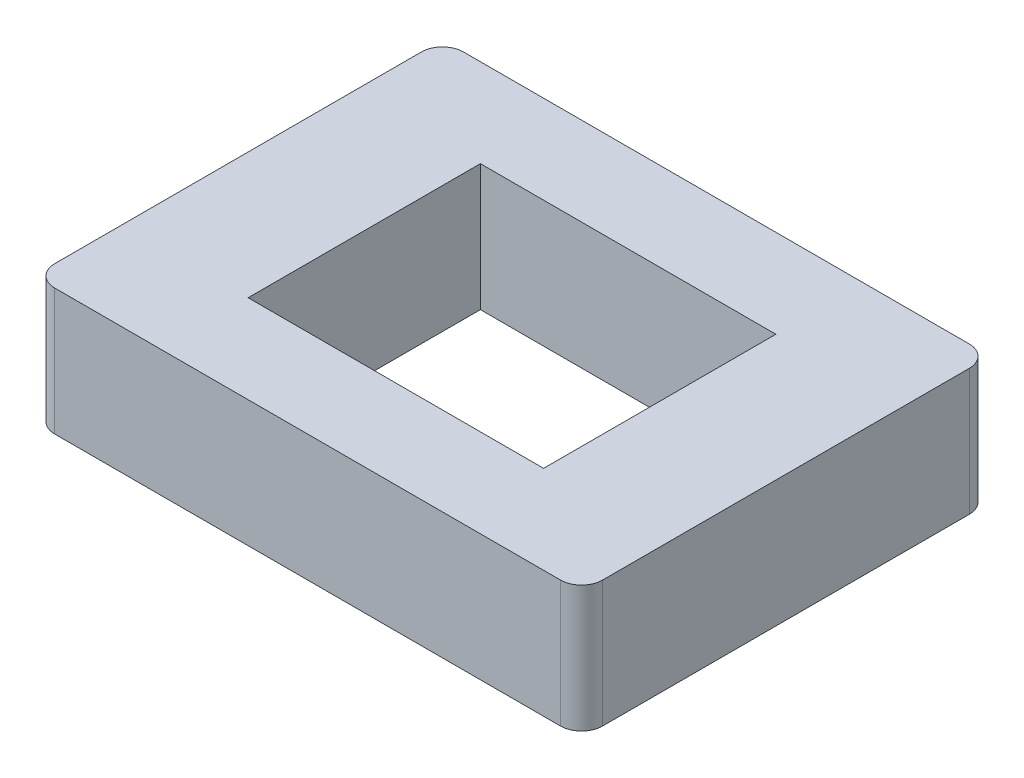
from build123d import *

# Parameters (mm, degrees)
SKETCH1_W           = 130
SKETCH1_H           = 97
BOSS_EXTRUDE1_DEPTH = 30
FILLET1_R           = 5
SKETCH2_W           = 70.1
SKETCH2_H           = 55.1
CUT_EXTRUDE3_DEPTH  = 87.471093436


with BuildPart() as part:
    # Sketch1 → Boss-Extrude1 (new body)
    with BuildSketch(Plane(origin=(0, 0, 0), x_dir=(1, 0, 0), z_dir=(0, 1, 0))):
        Rectangle(SKETCH1_W, SKETCH1_H)
    extrude(amount=-BOSS_EXTRUDE1_DEPTH)

    # Fillet1
    fillet1_edges = [part.edges().sort_by_distance(p)[0] for p in [
        (65, -15, 48.5),
        (-65, -15, 48.5),
        (-65, -15, -48.5),
        (65, -15, -48.5),
    ]]
    fillet(fillet1_edges, radius=FILLET1_R)

    # Sketch2 → Cut-Extrude3 (cut, through all)
    with BuildSketch(Plane(origin=(0, -30, 0), x_dir=(1, 0, 0), z_dir=(0, 1, 0))):
        Rectangle(SKETCH2_W, SKETCH2_H)
    extrude(amount=CUT_EXTRUDE3_DEPTH, mode=Mode.SUBTRACT)


solid = part.part
